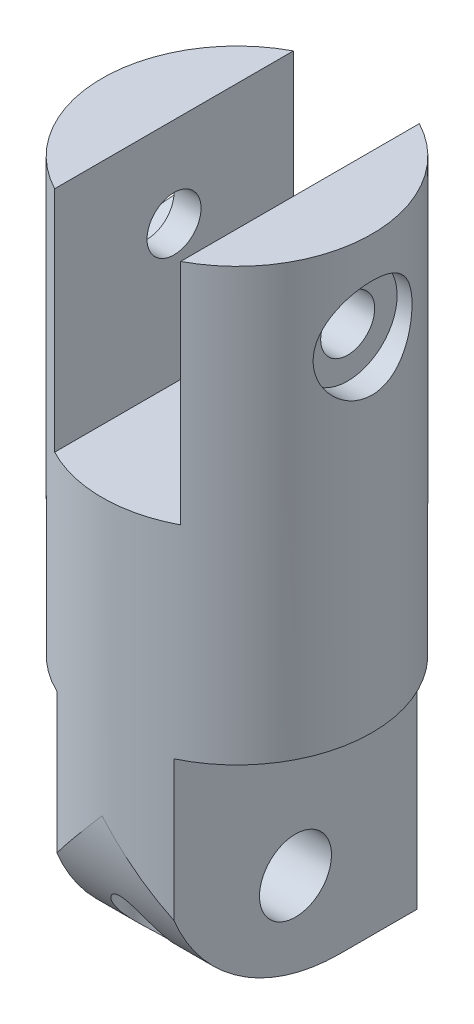
from build123d import *

# Parameters (mm, degrees)
SKETCH1_W           = 6.5
SKETCH1_H           = 14
BOSS_EXTRUDE1_DEPTH = 15
FILLET1_R           = 10
SKETCH2_R           = 2
CUT_EXTRUDE1_DEPTH  = 18.783419244
SKETCH4_R           = 7.5
BOSS_EXTRUDE2_DEPTH = 24
SKETCH6_W           = 7
SKETCH6_H           = 12.68
CUT_EXTRUDE2_DEPTH  = 36.245567097
CUT_EXTRUDE3_DEPTH  = 30.278831944
SKETCH8_R           = 1.5
CUT_EXTRUDE4_DEPTH  = 21
SKETCH9_R           = 2.75
CUT_EXTRUDE5_DEPTH  = 10
CUT_EXTRUDE6_DEPTH  = 10
SKETCH11_R          = 1.25
CUT_EXTRUDE7_DEPTH  = 24


with BuildPart() as part:
    # Sketch1 → Boss-Extrude1 (new body)
    with BuildSketch(Plane.XY):
        Rectangle(SKETCH1_W, SKETCH1_H)
    extrude(amount=BOSS_EXTRUDE1_DEPTH)

    # Fillet1
    fillet1_edges = [part.edges().sort_by_distance(p)[0] for p in [
        (0, -7, 15),
    ]]
    fillet(fillet1_edges, radius=FILLET1_R)

    # Sketch2 → Cut-Extrude1 (cut, through all)
    with BuildSketch(Plane(origin=(3.25, 0, 0), x_dir=(0, 0, -1), z_dir=(1, 0, 0))):
        with Locations(Location((-7.5, -2, 0), (0, 0, 90))):
            Circle(SKETCH2_R)
    extrude(amount=-CUT_EXTRUDE1_DEPTH, mode=Mode.SUBTRACT)

    # Sketch4 → Boss-Extrude2 (add)
    with BuildSketch(Plane(origin=(0, 7, 0), x_dir=(1, 0, 0), z_dir=(0, 1, 0))):
        with Locations(Location((0, -7.5, 0), (0, 0, 270))):
            Circle(SKETCH4_R)
    extrude(amount=BOSS_EXTRUDE2_DEPTH)

    # Sketch6 → Cut-Extrude2 (cut, through all)
    with BuildSketch(Plane(origin=(0, 0, 0), x_dir=(-1, 0, 0), z_dir=(0, 0, -1))):
        with Locations((0, 24.66)):
            Rectangle(SKETCH6_W, SKETCH6_H)
    extrude(amount=-CUT_EXTRUDE2_DEPTH, mode=Mode.SUBTRACT)

    # Sketch7 → Cut-Extrude3 (cut, through all)
    with BuildSketch(Plane(origin=(0, 7, 0), x_dir=(1, 0, 0), z_dir=(0, 1, 0))):
        with BuildLine():
            ThreePointArc((0, -15), (-1.666673801, -14.812468697), (-3.25, -14.259252917))
            Line((-3.25, -14.259252917), (-3.25, -15))
            Line((-3.25, -15), (0, -15))
        make_face()
        with BuildLine():
            ThreePointArc((3.25, -14.259252917), (1.666673801, -14.812468697), (0, -15))
            Line((0, -15), (3.25, -15))
            Line((3.25, -15), (3.25, -14.259252917))
        make_face()
        with BuildLine():
            ThreePointArc((-3.25, -0.740747083), (-1.666673801, -0.187531303), (0, 0))
            Line((0, 0), (-3.25, 0))
            Line((-3.25, 0), (-3.25, -0.740747083))
        make_face()
        with BuildLine():
            Line((3.25, 0), (0, 0))
            ThreePointArc((0, 0), (1.666673801, -0.187531303), (3.25, -0.740747083))
            Line((3.25, -0.740747083), (3.25, 0))
        make_face()
    extrude(amount=-CUT_EXTRUDE3_DEPTH, mode=Mode.SUBTRACT)

    # Sketch8 → Cut-Extrude4 (cut, symmetric)
    with BuildSketch(Plane(origin=(-3.5, 0, 0), x_dir=(0, 0, -1), z_dir=(1, 0, 0))):
        with Locations(Location((-7.5, 26, 0), (0, 0, 90))):
            Circle(SKETCH8_R)
    extrude(amount=CUT_EXTRUDE4_DEPTH, both=True, mode=Mode.SUBTRACT)

    # Sketch9 → Cut-Extrude5 (cut)
    with BuildSketch(Plane.ZY.offset(-6.15)):
        with Locations(Location((7.5, 26, 0), (0, 0, 270))):
            Circle(SKETCH9_R)
    extrude(amount=-CUT_EXTRUDE5_DEPTH, mode=Mode.SUBTRACT)

    # Sketch10 → Cut-Extrude6 (cut)
    with BuildSketch(Plane(origin=(-5, 0, 0), x_dir=(0, 0, -1), z_dir=(1, 0, 0))):
        Polygon((-7.5, 29.75277675), (-10.75, 27.876388375), (-10.75, 24.123611625), (-7.5, 22.24722325), (-4.25, 24.123611625), (-4.25, 27.876388375), align=None)
    extrude(amount=-CUT_EXTRUDE6_DEPTH, mode=Mode.SUBTRACT)

    # Sketch11 → Cut-Extrude7 (cut)
    with BuildSketch(Plane.XZ.offset(7)):
        with Locations(Location((0, 12.74882624, 0), (0, 0, 270))):
            Circle(SKETCH11_R)
        with Locations(Location((0, 3, 0), (0, 0, 270))):
            Circle(SKETCH11_R)
    extrude(amount=-CUT_EXTRUDE7_DEPTH, mode=Mode.SUBTRACT)


solid = part.part
